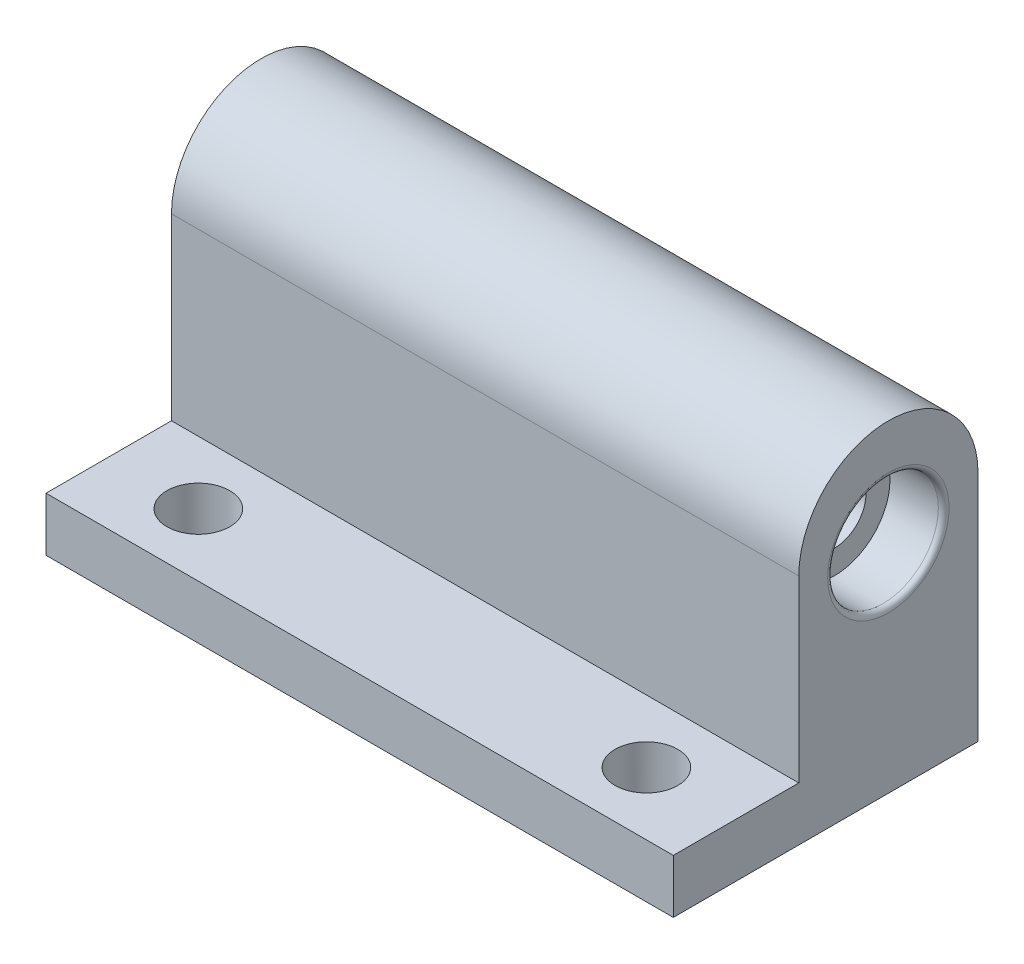
from build123d import *

# Parameters (mm, degrees)
SKETCH1_W           = 35
SKETCH1_H           = 30
BOSS_EXTRUDE1_DEPTH = 22.1
SKETCH2_R           = 3.0875
CUT_EXTRUDE1_DEPTH  = 3
SKETCH3_R           = 1.75
CUT_EXTRUDE2_DEPTH  = 42.682250419
CUT_EXTRUDE3_START  = -3
SKETCH4_R           = 3.0875
CUT_EXTRUDE3_DEPTH  = 3
SKETCH5_R           = 1.75
CUT_EXTRUDE4_DEPTH  = 32.932115495
CUT_EXTRUDE5_DEPTH  = 45.027377846
FILLET1_R           = 0.3
SKETCH7_W           = 35
SKETCH7_H           = 3
CUT_EXTRUDE6_DEPTH  = 10


with BuildPart() as part:
    # Sketch1 → Boss-Extrude1 (new body)
    with BuildSketch(Plane(origin=(0, 0, 0), x_dir=(1, 0, 0), z_dir=(0, 1, 0))):
        Rectangle(SKETCH1_W, SKETCH1_H)
    extrude(amount=BOSS_EXTRUDE1_DEPTH)

    # Sketch2 → Cut-Extrude1 (cut)
    with BuildSketch(Plane(origin=(17.5, 0, 0), x_dir=(0, 0, -1), z_dir=(1, 0, 0))):
        with Locations((0, 12.1)):
            Circle(SKETCH2_R)
    extrude(amount=-CUT_EXTRUDE1_DEPTH, mode=Mode.SUBTRACT)

    # Sketch3 → Cut-Extrude2 (cut, through all)
    with BuildSketch(Plane(origin=(14.5, 0, 0), x_dir=(0, 0, -1), z_dir=(1, 0, 0))):
        with Locations((0, 12.1)):
            Circle(SKETCH3_R)
    extrude(amount=-CUT_EXTRUDE2_DEPTH, mode=Mode.SUBTRACT)

    # Sketch4 → Cut-Extrude3 (cut)
    with BuildSketch(Plane.ZY.offset(17.5).offset(CUT_EXTRUDE3_START)):
        with Locations(Location((0, 12.1, 0), (0, 0, 180))):
            Circle(SKETCH4_R)
    extrude(amount=CUT_EXTRUDE3_DEPTH, mode=Mode.SUBTRACT)

    # Sketch5 → Cut-Extrude4 (cut, through all)
    with BuildSketch(Plane(origin=(0, 22.1, 0), x_dir=(1, 0, 0), z_dir=(0, 1, 0))):
        with Locations(Location((-12.5, 8.5, 0), (0, 0, 270))):
            Circle(SKETCH5_R)
        with Locations(Location((12.5, 8.5, 0), (0, 0, 270))):
            Circle(SKETCH5_R)
        with Locations(Location((12.5, -8.5, 0), (0, 0, 270))):
            Circle(SKETCH5_R)
        with Locations(Location((-12.5, -8.5, 0), (0, 0, 270))):
            Circle(SKETCH5_R)
    extrude(amount=-CUT_EXTRUDE4_DEPTH, mode=Mode.SUBTRACT)

    # Sketch6 → Cut-Extrude5 (cut, through all)
    with BuildSketch(Plane.ZY.offset(17.5)):
        with BuildLine():
            Line((-5, 3), (-5, 13))
            ThreePointArc((-5, 13), (0, 18), (5, 13))
            Line((5, 13), (5, 3))
            Line((5, 3), (15, 3))
            Line((15, 3), (15, 22.1))
            Line((15, 22.1), (-15, 22.1))
            Line((-15, 22.1), (-15, 3))
            Line((-15, 3), (-15, 0))
            Line((-15, 0), (-5, 0))
            Line((-5, 0), (-5, 3))
        make_face()
    extrude(amount=-CUT_EXTRUDE5_DEPTH, mode=Mode.SUBTRACT)

    # Fillet1
    fillet1_edges = [part.edges().sort_by_distance(p)[0] for p in [
        (17.5, 12.1, 3.0875),
        (-17.5, 12.1, 3.0875),
    ]]
    fillet(fillet1_edges, radius=FILLET1_R)

    # Sketch7 → Cut-Extrude6 (cut)
    with BuildSketch(Plane(origin=(0, 3, 0), x_dir=(1, 0, 0), z_dir=(0, 1, 0))):
        with Locations((0, -13.5)):
            Rectangle(SKETCH7_W, SKETCH7_H)
    extrude(amount=-CUT_EXTRUDE6_DEPTH, mode=Mode.SUBTRACT)


solid = part.part
